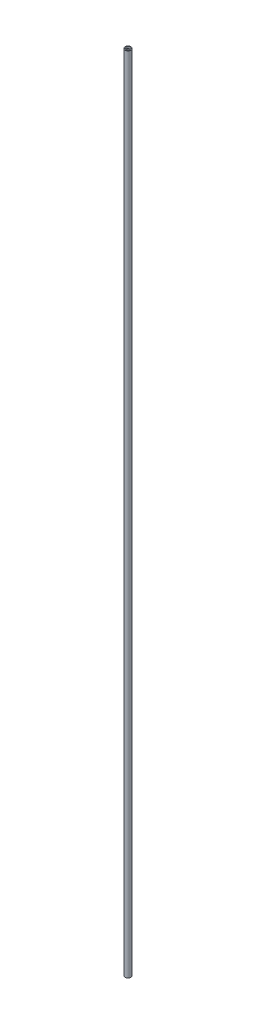
from build123d import *
from OCP.BRepFilletAPI import BRepFilletAPI_MakeChamfer

# Parameters (mm, degrees)
CROQUIS7_R              = 3.175
CROQUIS7_R_2            = 1.585
CHAFL_N2_SIZE           = 1
CHAFL_N2_SIZE2          = 0.577350269
CROQUIS7_3_R            = 3.175
CROQUIS7_3_R_2          = 1.585
SALIENTE_EXTRUIR2_DEPTH = 855
CHAFL_N3_SIZE           = 1
CHAFL_N3_SIZE2          = 0.577350269


with BuildPart() as part:
    # Barrer4: sweep along a path in Croquis6
    with BuildLine(Plane.XY) as barrer4_path:
        Line((0, 0), (0, 100))
        ThreePointArc((0, 100), (3.620568169, 173.605324125), (14.447316639, 246.5))
        ThreePointArc((14.447316639, 246.5), (208.645238435, 390.471063639), (370.979960645, 211.34))
        Line((370.979960645, 211.34), (370.979960645, 86))
    # Croquis7 → Barrer4 (sweep)
    with BuildSketch(Plane(origin=(0, 0, 0), x_dir=(1, 0, 0), z_dir=(0, 1, 0))):
        Circle(CROQUIS7_R)
        Circle(CROQUIS7_R_2, mode=Mode.SUBTRACT)
    sweep(path=barrer4_path.line)

    # Chaflán2: one chamfer whose edges measure the first distance from different faces: ONE call of the kernel's chamfer builder (chamfer() names one face for all edges)
    chafl_n2_edges_1 = [part.edges().sort_by_distance(p)[0] for p in [
        (-1.585, 0, 0),
    ]]
    chafl_n2_side_1 = [part.faces().sort_by_distance(p)[0] for p in [
        (-1.585, 50, 0),
    ]]
    chafl_n2_edges_2 = [part.edges().sort_by_distance(p)[0] for p in [
        (372.564960645, 86, 0),
    ]]
    chafl_n2_side_2 = [part.faces().sort_by_distance(p)[0] for p in [
        (372.564960645, 148.67, 0),
    ]]
    chafl_n2 = BRepFilletAPI_MakeChamfer(part.part.solid().wrapped)
    for e in chafl_n2_edges_1:
        chafl_n2.Add(CHAFL_N2_SIZE, CHAFL_N2_SIZE2, e.wrapped, chafl_n2_side_1[0].wrapped)  # the first distance lies on this face
    for e in chafl_n2_edges_2:
        chafl_n2.Add(CHAFL_N2_SIZE, CHAFL_N2_SIZE2, e.wrapped, chafl_n2_side_2[0].wrapped)  # the first distance lies on this face
    add(Compound.cast(chafl_n2.Shape()), mode=Mode.REPLACE)


with BuildPart() as body_2:
    # Croquis7<3> → Saliente-Extruir2 (new body)
    with BuildSketch(Plane(origin=(0, 0, 0), x_dir=(1, 0, 0), z_dir=(0, 1, 0))):
        Circle(CROQUIS7_3_R)
        Circle(CROQUIS7_3_R_2, mode=Mode.SUBTRACT)
    extrude(amount=SALIENTE_EXTRUIR2_DEPTH)

    # Chaflán3
    chafl_n3_edges = [body_2.edges().sort_by_distance(p)[0] for p in [
        (-1.585, 0, 0),
        (-1.585, 855, 0),
    ]]
    chafl_n3_side = [body_2.faces().sort_by_distance(p)[0] for p in [
        (-1.585, 427.5, 0),
    ]]
    chamfer(chafl_n3_edges, length=CHAFL_N3_SIZE, length2=CHAFL_N3_SIZE2, reference=chafl_n3_side[0])


solid = body_2.part
